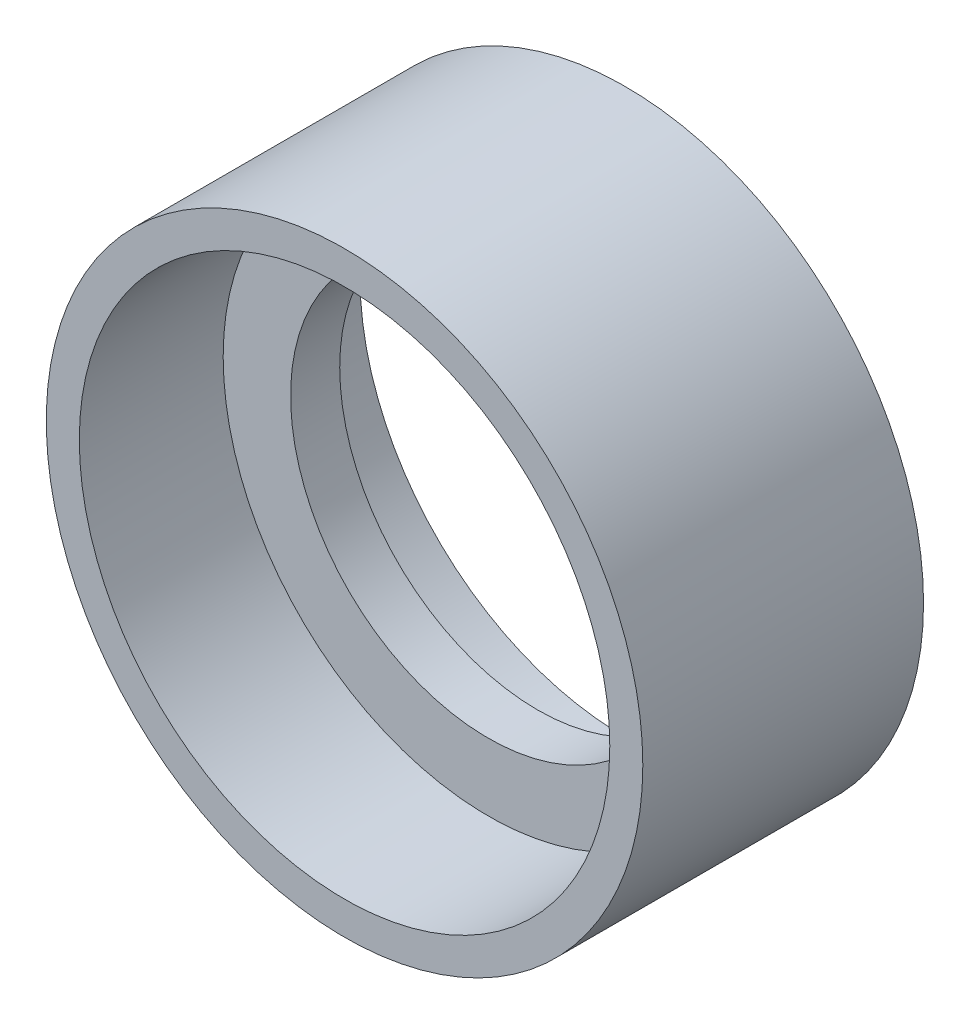
from build123d import *

# Parameters (mm, degrees)
SKETCH1_R           = 13.49375
BOSS_EXTRUDE1_DEPTH = 12.7
SKETCH3_R           = 12
CUT_EXTRUDE2_DEPTH  = 23.922752412
SKETCH4_R           = 12
BOSS_EXTRUDE2_DEPTH = 2.2225
SKETCH5_R           = 8.95
CUT_EXTRUDE3_DEPTH  = 21.162499961


with BuildPart() as part:
    # Sketch1 → Boss-Extrude1 (new body)
    with BuildSketch(Plane.XY):
        Circle(SKETCH1_R)
    extrude(amount=BOSS_EXTRUDE1_DEPTH)

    # Sketch3 → Cut-Extrude2 (cut, through all)
    with BuildSketch(Plane(origin=(0, 0, 0), x_dir=(-1, 0, 0), z_dir=(0, 0, -1))):
        Circle(SKETCH3_R)
    extrude(amount=-CUT_EXTRUDE2_DEPTH, mode=Mode.SUBTRACT)

    # Sketch4 → Boss-Extrude2 (add)
    with BuildSketch(Plane(origin=(0, 0, 3.96875), x_dir=(-1, 0, 0), z_dir=(0, 0, -1))):
        Circle(SKETCH4_R)
    extrude(amount=-BOSS_EXTRUDE2_DEPTH)

    # Sketch5 → Cut-Extrude3 (cut, through all)
    with BuildSketch(Plane.XY.offset(6.19125)):
        Circle(SKETCH5_R)
    extrude(amount=-CUT_EXTRUDE3_DEPTH, mode=Mode.SUBTRACT)


solid = part.part
